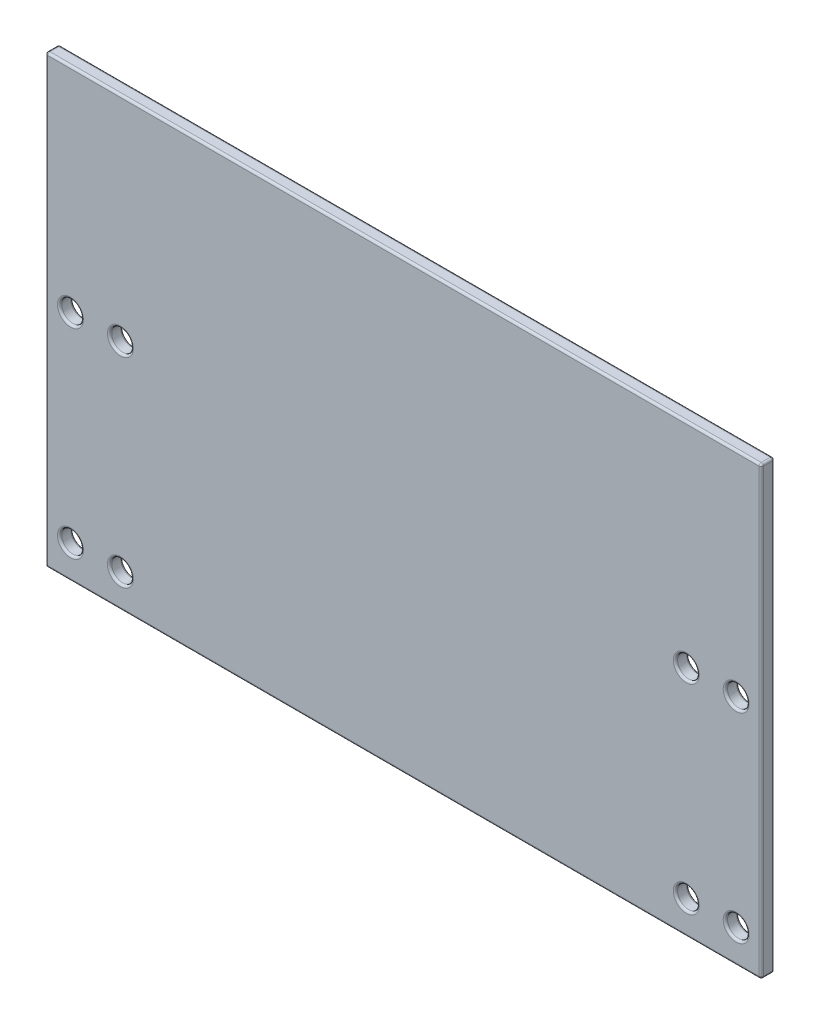
from build123d import *

# Parameters (mm, degrees)
CROQUIS1_W              = 107.5
CROQUIS1_H              = 67
CROQUIS1_R              = 1.625
SALIENTE_EXTRUIR1_DEPTH = 2
REDONDEO1_R             = 0.33


with BuildPart() as part:
    # Croquis1 → Saliente-Extruir1 (new body)
    with BuildSketch(Plane.XY):
        with Locations((53.75, 33.5)):
            Rectangle(CROQUIS1_W, CROQUIS1_H)
        with Locations((11.25, 35)):
            Circle(CROQUIS1_R, mode=Mode.SUBTRACT)
        with Locations((3.75, 35)):
            Circle(CROQUIS1_R, mode=Mode.SUBTRACT)
        with Locations((11.25, 5)):
            Circle(CROQUIS1_R, mode=Mode.SUBTRACT)
        with Locations((3.75, 5)):
            Circle(CROQUIS1_R, mode=Mode.SUBTRACT)
        with Locations((96.25, 35)):
            Circle(CROQUIS1_R, mode=Mode.SUBTRACT)
        with Locations((103.75, 35)):
            Circle(CROQUIS1_R, mode=Mode.SUBTRACT)
        with Locations((103.75, 5)):
            Circle(CROQUIS1_R, mode=Mode.SUBTRACT)
        with Locations((96.25, 5)):
            Circle(CROQUIS1_R, mode=Mode.SUBTRACT)
    extrude(amount=SALIENTE_EXTRUIR1_DEPTH)

    # Redondeo1
    redondeo1_edges = [part.edges().sort_by_distance(p)[0] for p in [
        (9.625, 35, 0),
        (9.625, 35, 2),
        (107.5, 33.5, 2),
        (2.125, 35, 0),
        (2.125, 35, 2),
        (53.75, 67, 2),
        (2.125, 5, 0),
        (2.125, 5, 2),
        (9.625, 5, 0),
        (9.625, 5, 2),
        (102.125, 35, 0),
        (102.125, 35, 2),
        (94.625, 35, 0),
        (94.625, 35, 2),
        (102.125, 5, 0),
        (102.125, 5, 2),
        (94.625, 5, 0),
        (94.625, 5, 2),
        (0, 33.5, 2),
        (53.75, 67, 0),
        (107.5, 33.5, 0),
        (53.75, 0, 0),
        (0, 33.5, 0),
        (0, 67, 1),
        (107.5, 67, 1),
        (107.5, 0, 1),
        (0, 0, 1),
        (53.75, 0, 2),
    ]]
    fillet(redondeo1_edges, radius=REDONDEO1_R)


solid = part.part
